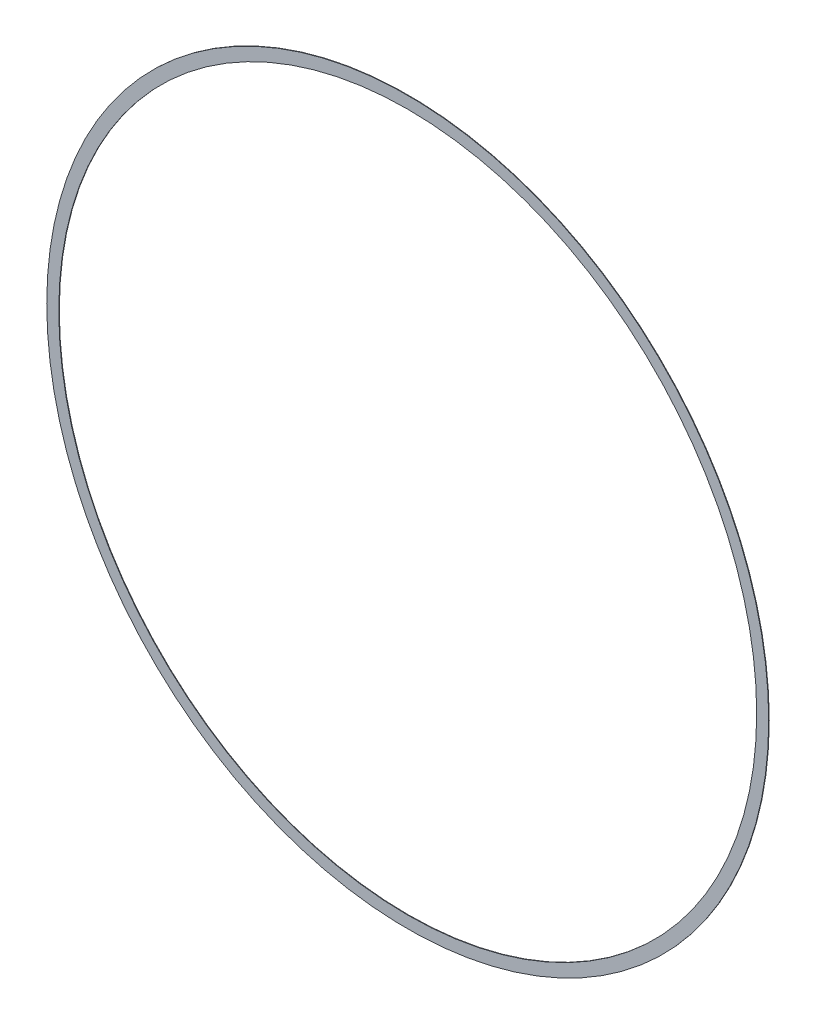
from build123d import *

# Parameters (mm, degrees)
SKETCH_1_R      = 750
SKETCH_1_R_2    = 725
EXTRUDE_1_DEPTH = 1.1


with BuildPart() as part:
    # 草图1 → 凸台-拉伸1 (new body)
    with BuildSketch(Plane.XY):
        Circle(SKETCH_1_R)
        Circle(SKETCH_1_R_2, mode=Mode.SUBTRACT)
    extrude(amount=EXTRUDE_1_DEPTH)


solid = part.part
